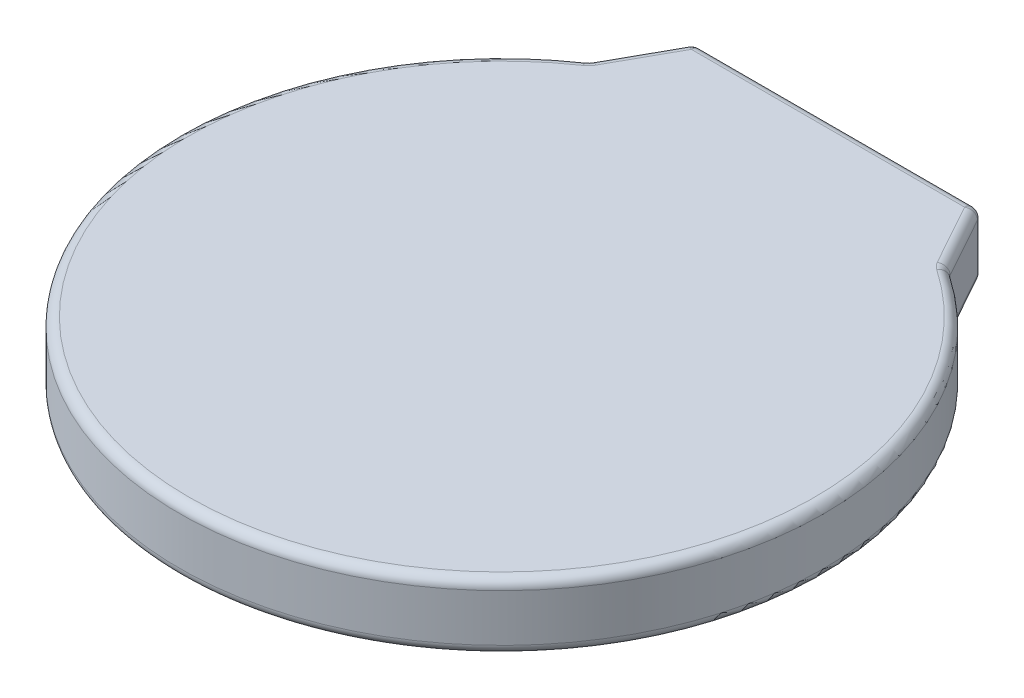
from build123d import *

# Parameters (mm, degrees)
SKETCH1_R           = 17
BOSS_EXTRUDE1_DEPTH = 3.5
FILLET1_R           = 0.5


with BuildPart() as part:
    # Sketch1 → Boss-Extrude1 (new body)
    with BuildSketch(Plane(origin=(0, 0, 0), x_dir=(1, 0, 0), z_dir=(0, 1, 0))):
        Circle(SKETCH1_R)
        with BuildLine():
            Line((7.5, 17.7), (-7.5, 17.7))
            Line((-7.5, 17.7), (-9.5, 14.09787218))
            ThreePointArc((-9.5, 14.09787218), (0, 17), (9.5, 14.09787218))
            Line((9.5, 14.09787218), (7.5, 17.7))
        make_face()
    extrude(amount=BOSS_EXTRUDE1_DEPTH)

    # Fillet1
    fillet1_edges = [part.edges().sort_by_distance(p)[0] for p in [
        (0, 3.5, -17.7),
        (-8.5, 3.5, -15.89893609),
        (0, 3.5, 17),
        (-8.5, 0, -15.89893609),
        (0, 0, -17.7),
        (8.5, 0, -15.89893609),
        (0, 0, 17),
        (8.5, 3.5, -15.89893609),
        (-9.5, 1.75, -14.09787218),
        (-7.5, 1.75, -17.7),
        (7.5, 1.75, -17.7),
        (9.5, 1.75, -14.09787218),
    ]]
    fillet(fillet1_edges, radius=FILLET1_R)


solid = part.part
